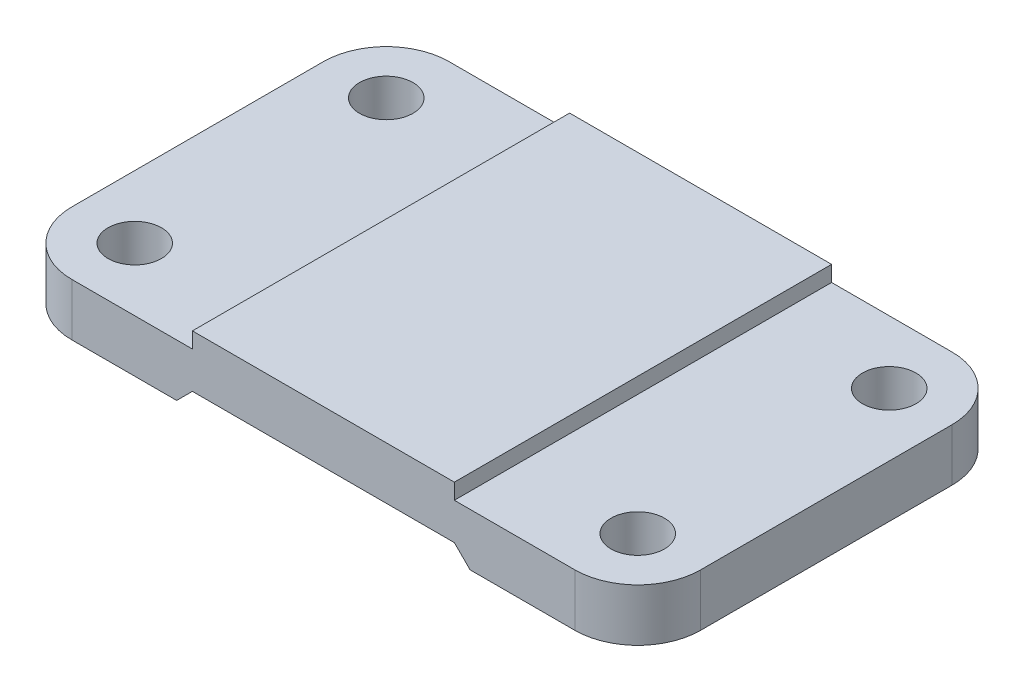
from build123d import *

# Parameters (mm, degrees)
SKETCH1_R               = 5.1
BOSS_EXTRUDE1_DEPTH     = 13
CUT_EXTRUDE1_DEPTH      = 72.168813395
CUT_EXTRUDE1_DEPTH_BACK = 72.168813395
SKETCH2_W               = 35
SKETCH2_H               = 3
CUT_EXTRUDE2_DEPTH      = 72.168813395
CUT_EXTRUDE2_DEPTH_BACK = 72.168813395


with BuildPart() as part:
    # Sketch1 → Boss-Extrude1 (new body)
    with BuildSketch(Plane(origin=(0, 0, 0), x_dir=(1, 0, 0), z_dir=(0, 1, 0))):
        with BuildLine():
            Line((-48, 36), (48, 36))
            ThreePointArc((48, 36), (56.485281374, 32.485281374), (60, 24))
            Line((60, 24), (60, -24))
            ThreePointArc((60, -24), (56.485281374, -32.485281374), (48, -36))
            Line((48, -36), (-48, -36))
            ThreePointArc((-48, -36), (-56.485281374, -32.485281374), (-60, -24))
            Line((-60, -24), (-60, 24))
            ThreePointArc((-60, 24), (-56.485281374, 32.485281374), (-48, 36))
        make_face()
        with Locations(Location((-48, 24, 0), (0, 0, 90))):
            Circle(SKETCH1_R, mode=Mode.SUBTRACT)
        with Locations(Location((-48, -24, 0), (0, 0, 90))):
            Circle(SKETCH1_R, mode=Mode.SUBTRACT)
        with Locations(Location((48, -24, 0), (0, 0, 90))):
            Circle(SKETCH1_R, mode=Mode.SUBTRACT)
        with Locations(Location((48, 24, 0), (0, 0, 90))):
            Circle(SKETCH1_R, mode=Mode.SUBTRACT)
    extrude(amount=BOSS_EXTRUDE1_DEPTH)

    # Sketch2 → Cut-Extrude1 (cut, two sides: drawn at the far end of the back side and taken through both)
    with BuildSketch(Plane.XY.offset(-CUT_EXTRUDE1_DEPTH_BACK)):
        with Locations((42.5, 11.5)):
            Rectangle(SKETCH2_W, SKETCH2_H)
        with Locations((-42.5, 11.5)):
            Rectangle(SKETCH2_W, SKETCH2_H)
    extrude(amount=CUT_EXTRUDE1_DEPTH + CUT_EXTRUDE1_DEPTH_BACK, mode=Mode.SUBTRACT)

    # Sketch3 → Cut-Extrude2 (cut, two sides: drawn at the far end of the back side and taken through both)
    with BuildSketch(Plane.XY.offset(-CUT_EXTRUDE2_DEPTH_BACK)):
        Polygon((-28, 0), (0, 0), (0, 3), (-25, 3), align=None)
        Polygon((0, 3), (0, 0), (27.016742068, 0), (28, 0), (25, 3), align=None)
    extrude(amount=CUT_EXTRUDE2_DEPTH + CUT_EXTRUDE2_DEPTH_BACK, mode=Mode.SUBTRACT)


solid = part.part
